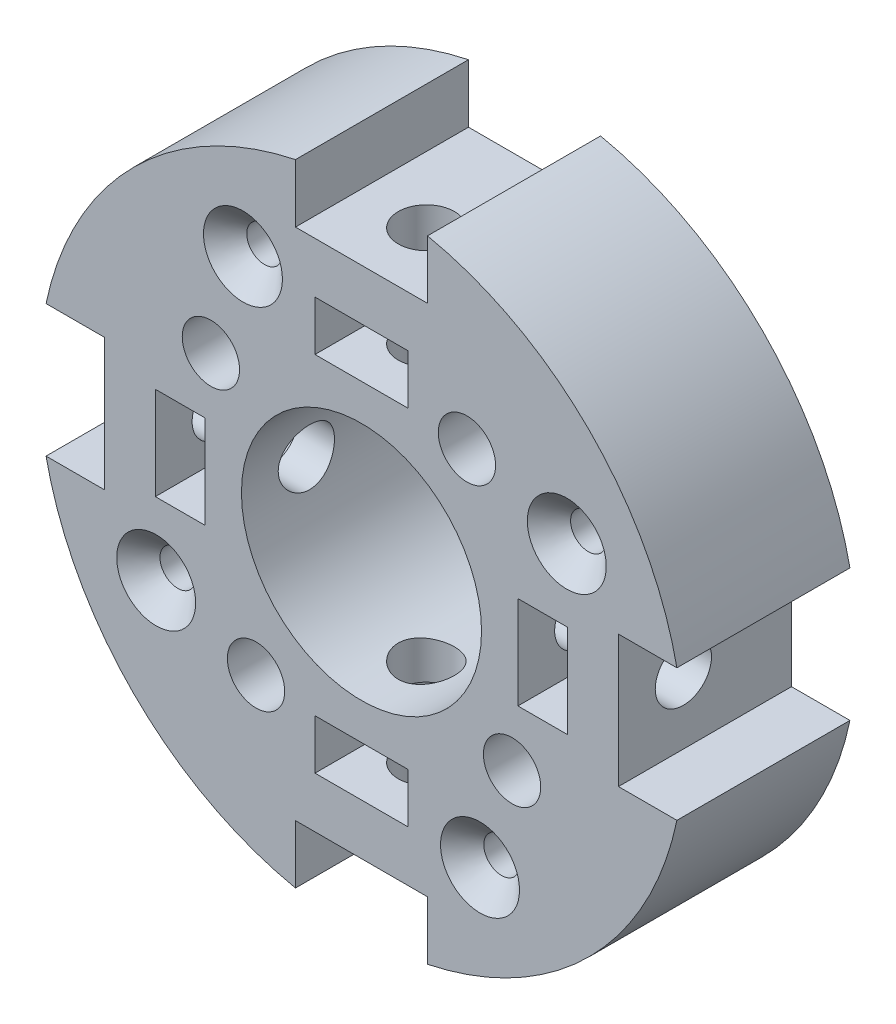
from build123d import *

# Parameters (mm, degrees)
ESQUISSE1_R                  = 11.1
ESQUISSE1_R_2                = 1.65
ESQUISSE1_R_3                = 2.65
ESQUISSE1_W                  = 8.6
ESQUISSE1_H                  = 4.6
ESQUISSE1_W_2                = 4.6
ESQUISSE1_H_2                = 8.6
BOSS_EXTRU_1_DEPTH           = 16
ENL_V_MAT_EXTRU_3_DEPTH      = 10
CHANFREIN1_SIZE              = 2
ESQUISSE6_R                  = 2.6
ENL_V_MAT_EXTRU_4_DEPTH      = 17
R_P_TITION_CIRCULAIRE1_COUNT = 4


with BuildPart() as part:
    # Esquisse1 → Boss.-Extru.1 (new body)
    with BuildSketch(Plane.XY):
        with BuildLine():
            Line((-6.105930323, 29.167749568), (-6.105930323, 23.762922109))
            Line((-6.105930323, 23.762922109), (6.105930323, 23.762922109))
            Line((6.105930323, 23.762922109), (6.105930323, 29.167749568))
            ThreePointArc((6.105930323, 29.167749568), (21.071782079, 21.071782079), (29.167749568, 6.105930323))
            Line((29.167749568, 6.105930323), (23.762922109, 6.105930323))
            Line((23.762922109, 6.105930323), (23.762922109, -6.105930323))
            Line((23.762922109, -6.105930323), (29.167749568, -6.105930323))
            ThreePointArc((29.167749568, -6.105930323), (21.071782079, -21.071782079), (6.105930323, -29.167749568))
            Line((6.105930323, -29.167749568), (6.105930323, -23.762922109))
            Line((6.105930323, -23.762922109), (-6.105930323, -23.762922109))
            Line((-6.105930323, -23.762922109), (-6.105930323, -29.167749568))
            ThreePointArc((-6.105930323, -29.167749568), (-21.071782079, -21.071782079), (-29.167749568, -6.105930323))
            Line((-29.167749568, -6.105930323), (-23.762922109, -6.105930323))
            Line((-23.762922109, -6.105930323), (-23.762922109, 6.105930323))
            Line((-23.762922109, 6.105930323), (-29.167749568, 6.105930323))
            ThreePointArc((-29.167749568, 6.105930323), (-21.071782079, 21.071782079), (-6.105930323, 29.167749568))
        make_face()
        Circle(ESQUISSE1_R, mode=Mode.SUBTRACT)
        with Locations((-10.960155108, 18.983545507)):
            Circle(ESQUISSE1_R_2, mode=Mode.SUBTRACT)
        with Locations((18.983545507, 10.960155108)):
            Circle(ESQUISSE1_R_2, mode=Mode.SUBTRACT)
        with Locations((10.960155108, -18.983545507)):
            Circle(ESQUISSE1_R_2, mode=Mode.SUBTRACT)
        with Locations((-18.983545507, -10.960155108)):
            Circle(ESQUISSE1_R_2, mode=Mode.SUBTRACT)
        with Locations((-13.925584753, 9.750799418)):
            Circle(ESQUISSE1_R_3, mode=Mode.SUBTRACT)
        with Locations((9.750799418, 13.925584753)):
            Circle(ESQUISSE1_R_3, mode=Mode.SUBTRACT)
        with Locations((13.925584753, -9.750799418)):
            Circle(ESQUISSE1_R_3, mode=Mode.SUBTRACT)
        with Locations((-9.750799418, -13.925584753)):
            Circle(ESQUISSE1_R_3, mode=Mode.SUBTRACT)
        with Locations((0, 16.762922109)):
            Rectangle(ESQUISSE1_W, ESQUISSE1_H, mode=Mode.SUBTRACT)
        with Locations((16.762922109, 0)):
            Rectangle(ESQUISSE1_W_2, ESQUISSE1_H_2, mode=Mode.SUBTRACT)
        with Locations((0, -16.762922109)):
            Rectangle(ESQUISSE1_W, ESQUISSE1_H, mode=Mode.SUBTRACT)
        with Locations((-16.762922109, 0)):
            Rectangle(ESQUISSE1_W_2, ESQUISSE1_H_2, mode=Mode.SUBTRACT)
    extrude(amount=BOSS_EXTRU_1_DEPTH)

    # Esquisse5 → Enlèv. mat.-Extru.3 (cut)
    with BuildSketch(Plane(origin=(0, 0, 0), x_dir=(-1, 0, 0), z_dir=(0, 0, -1))):
        Polygon((9.191312546, 9.750799418), (11.558448649, 5.650799418), (16.292720857, 5.650799418), (18.65985696, 9.750799418), (16.292720857, 13.850799418), (11.558448649, 13.850799418), align=None)
        Polygon((-9.750799418, 9.191312546), (-5.650799418, 11.558448649), (-5.650799418, 16.292720857), (-9.750799418, 18.65985696), (-13.850799418, 16.292720857), (-13.850799418, 11.558448649), align=None)
        Polygon((9.750799418, -9.191312546), (5.650799418, -11.558448649), (5.650799418, -16.292720857), (9.750799418, -18.65985696), (13.850799418, -16.292720857), (13.850799418, -11.558448649), align=None)
        Polygon((-9.191312546, -9.750799418), (-11.558448649, -5.650799418), (-16.292720857, -5.650799418), (-18.65985696, -9.750799418), (-16.292720857, -13.850799418), (-11.558448649, -13.850799418), align=None)
    extrude(amount=-ENL_V_MAT_EXTRU_3_DEPTH, mode=Mode.SUBTRACT)

    # Chanfrein1
    chanfrein1_edges = [part.edges().sort_by_distance(p)[0] for p in [
        (-12.610155108, 18.983545507, 16),
        (17.333545507, 10.960155108, 16),
        (9.310155108, -18.983545507, 16),
        (-20.633545507, -10.960155108, 16),
    ]]
    chamfer(chanfrein1_edges, length=CHANFREIN1_SIZE)

    # Esquisse6 → Enlèv. mat.-Extru.4 (cut)
    with BuildSketch(Plane.ZY.offset(23.762922109)):
        with Locations((10, 0)):
            Circle(ESQUISSE6_R)
    enl_v_mat_extru_4 = extrude(amount=-ENL_V_MAT_EXTRU_4_DEPTH, mode=Mode.SUBTRACT)

    # Répétition circulaire1: Enlèv. mat.-Extru.4 ×4 about axis
    r_p_tition_circulaire1_axis = Axis((0, 0, 0), (0, 0, 1))
    for i in range(1, R_P_TITION_CIRCULAIRE1_COUNT):
        add(enl_v_mat_extru_4.rotate(r_p_tition_circulaire1_axis, i * 360 / R_P_TITION_CIRCULAIRE1_COUNT), mode=Mode.SUBTRACT)


solid = part.part
